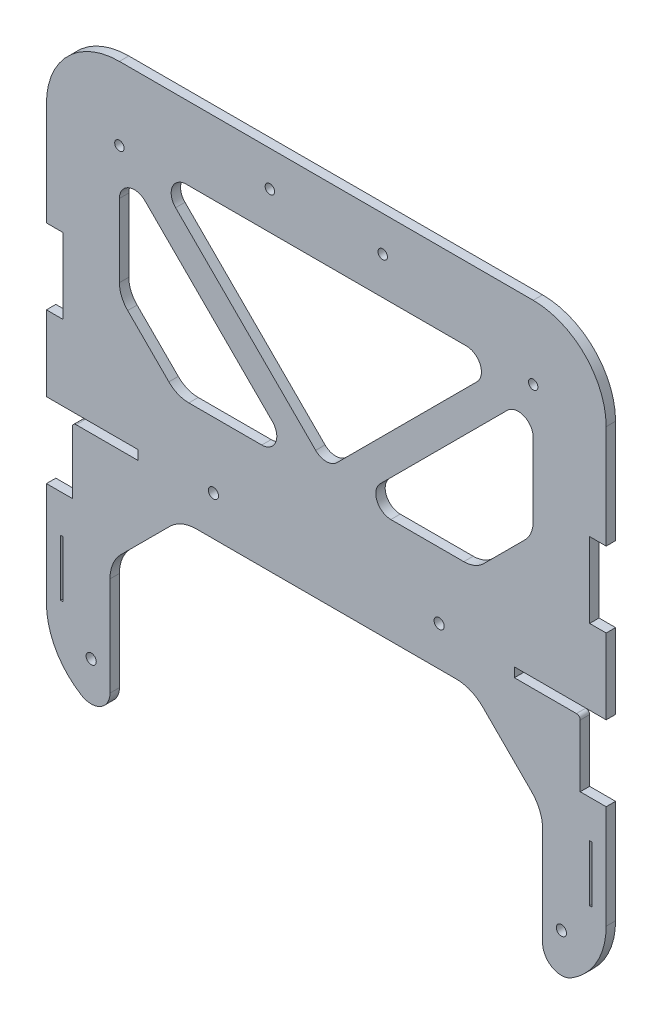
from build123d import *

# Parameters (mm, degrees)
SKETCH1_R           = 1.7145
SKETCH1_W           = 0.79375
SKETCH1_H           = 19.05
SKETCH1_R_2         = 1.5875
BOSS_EXTRUDE1_DEPTH = 3.175


with BuildPart() as part:
    # Sketch1 → Boss-Extrude1 (new body)
    with BuildSketch(Plane.XY.offset(-196.85)):
        with BuildLine():
            Line((-85.725, -136.525), (-94.488, -136.525))
            Line((-94.488, -136.525), (-94.488, -171.45))
            ThreePointArc((-94.488, -171.45), (-91.334797487, -183.509623583), (-82.682291667, -192.482435298))
            ThreePointArc((-82.682291667, -192.482435298), (-76.266849592, -192.599023491), (-73.025, -187.061704551))
            Line((-73.025, -187.061704551), (-73.025, -153.666835653))
            ThreePointArc((-73.025, -153.666835653), (-72.058270063, -148.806756062), (-69.305256121, -144.686579532))
            Line((-69.305256121, -144.686579532), (-52.819423728, -128.200747139))
            ThreePointArc((-52.819423728, -128.200747139), (-48.699247198, -125.447733197), (-43.839167607, -124.48100326))
            Line((-43.839167607, -124.48100326), (43.839167607, -124.48100326))
            ThreePointArc((43.839167607, -124.48100326), (48.699247198, -125.447733197), (52.819423728, -128.200747139))
            Line((52.819423728, -128.200747139), (69.305256121, -144.686579532))
            ThreePointArc((69.305256121, -144.686579532), (72.058270063, -148.806756062), (73.025, -153.666835653))
            Line((73.025, -153.666835653), (73.025, -187.061704551))
            ThreePointArc((73.025, -187.061704551), (76.266849592, -192.599023491), (82.682291667, -192.482435298))
            ThreePointArc((82.682291667, -192.482435298), (91.334797487, -183.509623583), (94.488, -171.45))
            Line((94.488, -171.45), (94.488, -136.525))
            Line((94.488, -136.525), (85.725, -136.525))
            Line((85.725, -136.525), (85.725, -115.57))
            ThreePointArc((85.725, -115.57), (85.353025612, -114.671974388), (84.455, -114.3))
            Line((84.455, -114.3), (63.5, -114.3))
            Line((63.5, -114.3), (63.5, -111.125))
            Line((63.5, -111.125), (94.488, -111.125))
            Line((94.488, -111.125), (94.488, -85.725))
            Line((94.488, -85.725), (88.9, -85.725))
            Line((88.9, -85.725), (88.9, -60.325))
            Line((88.9, -60.325), (94.488, -60.325))
            Line((94.488, -60.325), (94.488, -25.4))
            ThreePointArc((94.488, -25.4), (87.271696875, -7.978303125), (69.85, -0.762))
            Line((69.85, -0.762), (-69.85, -0.762))
            ThreePointArc((-69.85, -0.762), (-87.271696875, -7.978303125), (-94.488, -25.4))
            Line((-94.488, -25.4), (-94.488, -60.325))
            Line((-94.488, -60.325), (-88.9, -60.325))
            Line((-88.9, -60.325), (-88.9, -85.725))
            Line((-88.9, -85.725), (-94.488, -85.725))
            Line((-94.488, -85.725), (-94.488, -111.125))
            Line((-94.488, -111.125), (-63.5, -111.125))
            Line((-63.5, -111.125), (-63.5, -114.3))
            Line((-63.5, -114.3), (-84.455, -114.3))
            ThreePointArc((-84.455, -114.3), (-85.353025612, -114.671974388), (-85.725, -115.57))
            Line((-85.725, -115.57), (-85.725, -136.525))
        make_face()
        with Locations((-79.375, -180.213)):
            Circle(SKETCH1_R, mode=Mode.SUBTRACT)
        with Locations((-89.296875, -158.75)):
            Rectangle(SKETCH1_W, SKETCH1_H, mode=Mode.SUBTRACT)
        with Locations((-38.1, -111.125)):
            Circle(SKETCH1_R, mode=Mode.SUBTRACT)
        with Locations((79.375, -180.213)):
            Circle(SKETCH1_R, mode=Mode.SUBTRACT)
        with Locations((89.296875, -158.75)):
            Rectangle(SKETCH1_W, SKETCH1_H, mode=Mode.SUBTRACT)
        with Locations((38.1, -111.125)):
            Circle(SKETCH1_R, mode=Mode.SUBTRACT)
        with BuildLine():
            ThreePointArc((-67.060192091, -72.204012806), (-69.124952547, -69.113880409), (-69.85, -65.468820715))
            Line((-69.85, -65.468820715), (-69.85, -40.839204897))
            ThreePointArc((-69.85, -40.839204897), (-66.714031836, -36.145896872), (-61.177897552, -37.247102448))
            Line((-61.177897552, -37.247102448), (-18.197102448, -80.227897552))
            ThreePointArc((-18.197102448, -80.227897552), (-17.095896872, -85.764031836), (-21.789204897, -88.9))
            Line((-21.789204897, -88.9), (-46.418820715, -88.9))
            ThreePointArc((-46.418820715, -88.9), (-50.063880409, -88.174952547), (-53.154012806, -86.110192091))
            Line((-53.154012806, -86.110192091), (-67.060192091, -72.204012806))
        make_face(mode=Mode.SUBTRACT)
        with Locations((-69.85, -25.4)):
            Circle(SKETCH1_R_2, mode=Mode.SUBTRACT)
        with Locations((-19.05, -12.7)):
            Circle(SKETCH1_R_2, mode=Mode.SUBTRACT)
        with BuildLine():
            ThreePointArc((3.592102448, -81.36251337), (0, -82.850410922), (-3.592102448, -81.36251337))
            Line((-3.592102448, -81.36251337), (-50.88251337, -34.072102448))
            ThreePointArc((-50.88251337, -34.072102448), (-51.983718947, -28.535968164), (-47.290410922, -25.4))
            Line((-47.290410922, -25.4), (47.290410922, -25.4))
            ThreePointArc((47.290410922, -25.4), (51.983718947, -28.535968164), (50.88251337, -34.072102448))
            Line((50.88251337, -34.072102448), (3.592102448, -81.36251337))
        make_face(mode=Mode.SUBTRACT)
        with BuildLine():
            ThreePointArc((53.154012806, -86.110192091), (50.063880409, -88.174952547), (46.418820715, -88.9))
            Line((46.418820715, -88.9), (21.789204897, -88.9))
            ThreePointArc((21.789204897, -88.9), (17.095896872, -85.764031836), (18.197102448, -80.227897552))
            Line((18.197102448, -80.227897552), (61.177897552, -37.247102448))
            ThreePointArc((61.177897552, -37.247102448), (66.714031836, -36.145896872), (69.85, -40.839204897))
            Line((69.85, -40.839204897), (69.85, -65.468820715))
            ThreePointArc((69.85, -65.468820715), (69.124952547, -69.113880409), (67.060192091, -72.204012806))
            Line((67.060192091, -72.204012806), (53.154012806, -86.110192091))
        make_face(mode=Mode.SUBTRACT)
        with Locations((19.05, -12.7)):
            Circle(SKETCH1_R_2, mode=Mode.SUBTRACT)
        with Locations((69.85, -25.4)):
            Circle(SKETCH1_R_2, mode=Mode.SUBTRACT)
    extrude(amount=-BOSS_EXTRUDE1_DEPTH)


solid = part.part
